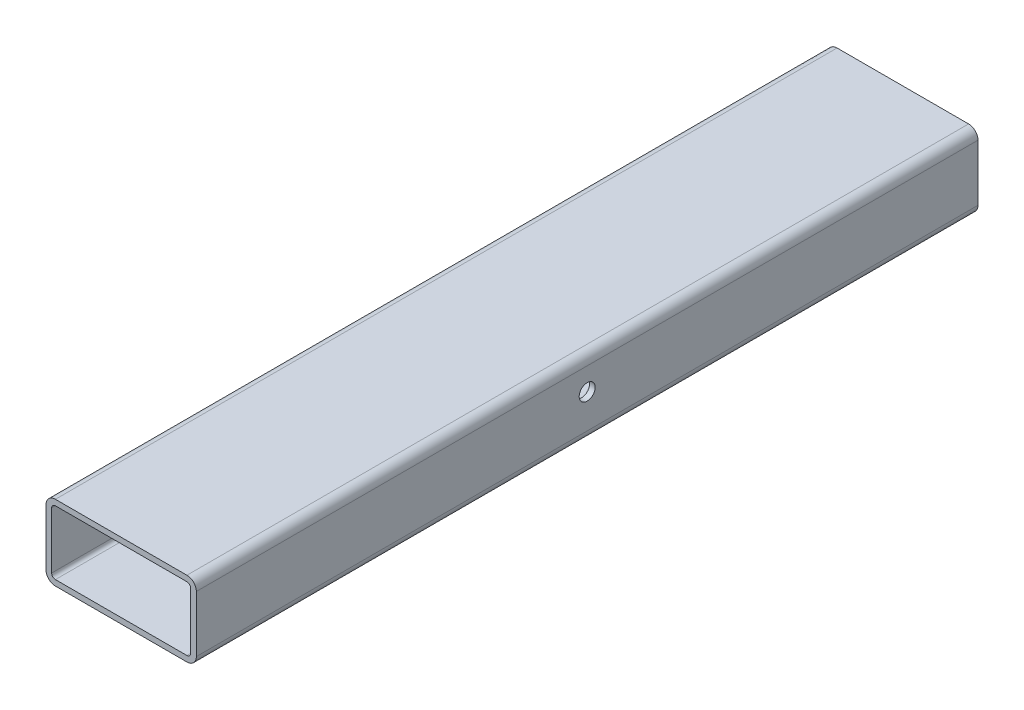
from build123d import *

# Parameters (mm, degrees)
EXTRUDE_1_DEPTH        = 208
HOLE_WIZARD_M101_D     = 8.5
HOLE_WIZARD_M101_DEPTH = 27.5
HOLE_WIZARD_M101_TIP   = 2.553657631


with BuildPart() as part:
    # Эскиз1 → Бобышка-Вытянуть1 (new, symmetric)
    with BuildSketch(Plane.XY):
        with BuildLine():
            Line((-35, -20), (35, -20))
            ThreePointArc((35, -20), (38.535533906, -18.535533906), (40, -15))
            Line((40, -15), (40, 15))
            ThreePointArc((40, 15), (38.535533906, 18.535533906), (35, 20))
            Line((35, 20), (-35, 20))
            ThreePointArc((-35, 20), (-38.535533906, 18.535533906), (-40, 15))
            Line((-40, 15), (-40, -15))
            ThreePointArc((-40, -15), (-38.535533906, -18.535533906), (-35, -20))
        make_face()
        with BuildLine():
            Line((-35, -17), (35, -17))
            ThreePointArc((35, -17), (36.414213562, -16.414213562), (37, -15))
            Line((37, -15), (37, 15))
            ThreePointArc((37, 15), (36.414213562, 16.414213562), (35, 17))
            Line((35, 17), (-35, 17))
            ThreePointArc((-35, 17), (-36.414213562, 16.414213562), (-37, 15))
            Line((-37, 15), (-37, -15))
            ThreePointArc((-37, -15), (-36.414213562, -16.414213562), (-35, -17))
        make_face(mode=Mode.SUBTRACT)
    extrude(amount=EXTRUDE_1_DEPTH, both=True)

    # Отверстие обработанное метчиком M101
    with Locations(Plane(origin=(40, 0, 0), x_dir=(0, 0, -1), z_dir=(1, 0, 0))):
        with Locations((400, 3), (0, 3), (-400, 3)):
            Hole(HOLE_WIZARD_M101_D / 2, depth=HOLE_WIZARD_M101_DEPTH)
            with Locations((0, 0, -(HOLE_WIZARD_M101_DEPTH + HOLE_WIZARD_M101_TIP / 2))):  # 118° drill point
                Cone(0, HOLE_WIZARD_M101_D / 2, HOLE_WIZARD_M101_TIP, mode=Mode.SUBTRACT)


solid = part.part
